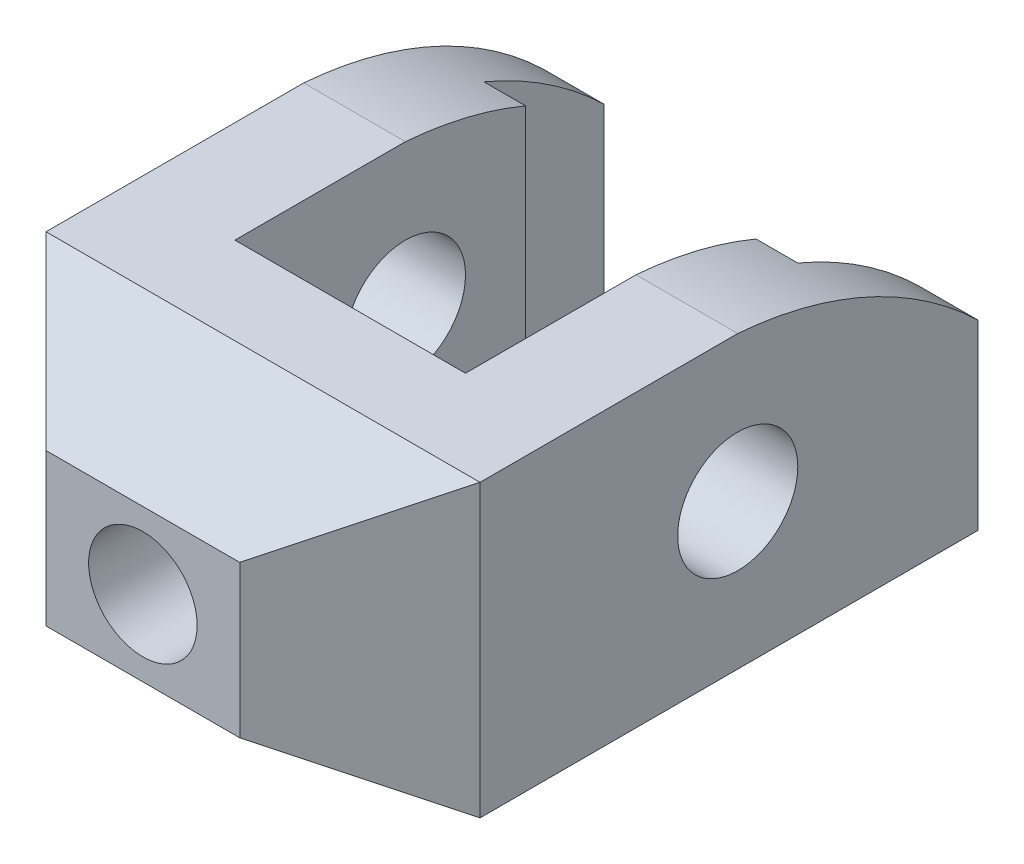
from build123d import *

# Parameters (mm, degrees)
BOSS_EXTRUDE1_DEPTH     = 150
CUT_EXTRUDE1_DEPTH      = 112
CUT_EXTRUDE1_DEPTH_BACK = 112
CUT_EXTRUDE2_DEPTH      = 112
CUT_EXTRUDE2_DEPTH_BACK = 112
SKETCH5_R               = 28
CUT_EXTRUDE3_DEPTH      = 50
SKETCH6_R               = 31
CUT_EXTRUDE4_DEPTH      = 224


with BuildPart() as part:
    # Sketch1 → Boss-Extrude1 (new body)
    with BuildSketch(Plane(origin=(0, 0, 0), x_dir=(1, 0, 0), z_dir=(0, 1, 0))):
        Polygon((59.5, 0), (-59.5, 0), (-59.5, 150), (-81, 150), (-81, 212), (-112, 212), (-112, -45), (-50, -107), (50, -107), (112, -45), (112, 212), (81, 212), (81, 150), (59.5, 150), align=None)
    extrude(amount=BOSS_EXTRUDE1_DEPTH)

    # Sketch3 → Cut-Extrude1 (cut, two sides: drawn at the far end of the back side and taken through both)
    with BuildSketch(Plane(origin=(0, 0, 0), x_dir=(0, 0, -1), z_dir=(1, 0, 0)).offset(-CUT_EXTRUDE1_DEPTH_BACK)):
        Polygon((-107, 150), (-107, 114.20428331), (-45, 150), align=None)
        Polygon((-107, 0), (-45, 0), (-107, 35.79571669), align=None)
    extrude(amount=CUT_EXTRUDE1_DEPTH + CUT_EXTRUDE1_DEPTH_BACK, mode=Mode.SUBTRACT)

    # Sketch4 → Cut-Extrude2 (cut, two sides: drawn at the far end of the back side and taken through both)
    with BuildSketch(Plane(origin=(0, 0, 0), x_dir=(0, 0, -1), z_dir=(1, 0, 0)).offset(-CUT_EXTRUDE2_DEPTH_BACK)):
        with BuildLine():
            Line((212, 150), (88, 150))
            ThreePointArc((88, 150), (154.908396662, 132.868592609), (212, 94))
            Line((212, 94), (212, 150))
        make_face()
    extrude(amount=CUT_EXTRUDE2_DEPTH + CUT_EXTRUDE2_DEPTH_BACK, mode=Mode.SUBTRACT)

    # Sketch5 → Cut-Extrude3 (cut)
    with BuildSketch(Plane.XY.offset(107)):
        with Locations((0, 75)):
            Circle(SKETCH5_R)
    extrude(amount=-CUT_EXTRUDE3_DEPTH, mode=Mode.SUBTRACT)

    # Sketch6 → Cut-Extrude4 (cut)
    with BuildSketch(Plane(origin=(112, 0, 0), x_dir=(0, 0, -1), z_dir=(1, 0, 0))):
        with Locations((88, 75)):
            Circle(SKETCH6_R)
    extrude(amount=-CUT_EXTRUDE4_DEPTH, mode=Mode.SUBTRACT)


solid = part.part
